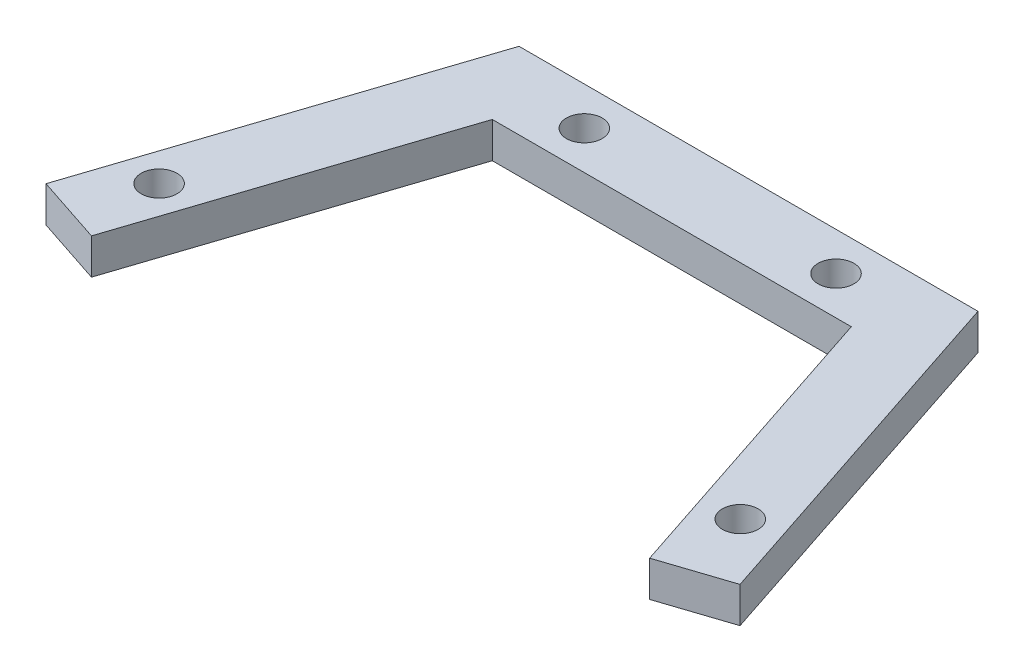
from build123d import *

# Parameters (mm, degrees)
SKETCH1_R           = 2
BOSS_EXTRUDE1_DEPTH = 2


with BuildPart() as part:
    # Sketch1 → Boss-Extrude1 (new, symmetric)
    with BuildSketch(Plane(origin=(0, 0, 0), x_dir=(1, 0, 0), z_dir=(0, 1, 0))):
        Polygon((-20.075, -4.29), (20.075, -4.29), (31.213284153, -37.981235074), (38.808958551, -35.470113721), (25.664309991, 4.29), (20.075, 4.29), (-20.075, 4.29), (-25.664309991, 4.29), (-38.808958551, -35.470113721), (-31.213284153, -37.981235074), align=None)
        with Locations(Location((14.075, 0, 0), (0, 0, 270))):
            Circle(SKETCH1_R, mode=Mode.SUBTRACT)
        with Locations(Location((-14.075, 0, 0), (0, 0, 90))):
            Circle(SKETCH1_R, mode=Mode.SUBTRACT)
        with Locations(Location((-32.5, -29.13, 0), (0, 0, 270))):
            Circle(SKETCH1_R, mode=Mode.SUBTRACT)
        with Locations(Location((32.5, -29.13, 0), (0, 0, 90))):
            Circle(SKETCH1_R, mode=Mode.SUBTRACT)
    extrude(amount=BOSS_EXTRUDE1_DEPTH, both=True)


solid = part.part
